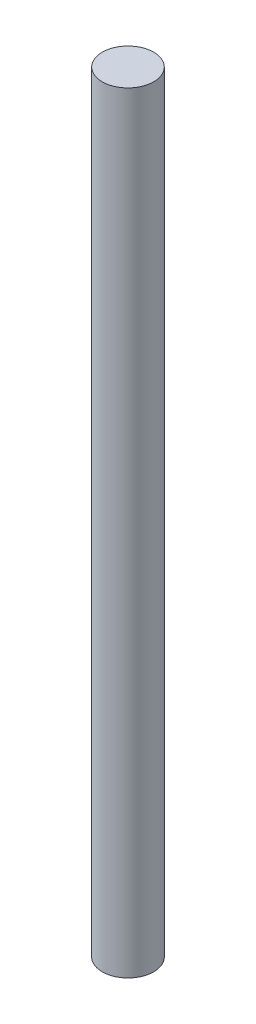
from build123d import *

# Parameters (mm, degrees)
SKETCH_1_R      = 2.5
EXTRUDE_1_DEPTH = 37.5


with BuildPart() as part:
    # ｽｹｯﾁ1 → ﾎﾞｽ - 押し出し1 (new, symmetric)
    with BuildSketch(Plane(origin=(0, 0, 0), x_dir=(1, 0, 0), z_dir=(0, 1, 0))):
        with Locations(Location((0, 0, 0), (0, 0, 270))):
            Circle(SKETCH_1_R)
    extrude(amount=EXTRUDE_1_DEPTH, both=True)


solid = part.part
